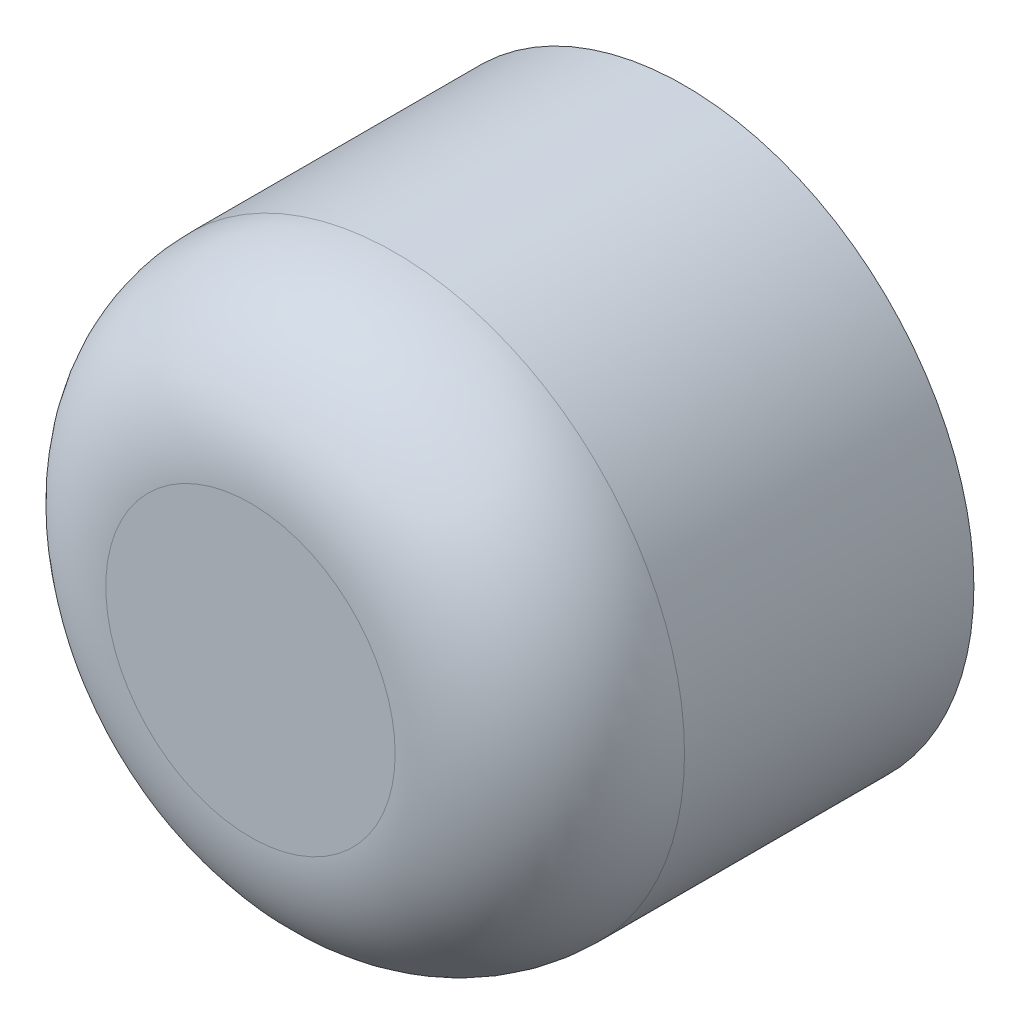
from build123d import *

# Parameters (mm, degrees)
SKETCH2_R           = 50.8
BOSS_EXTRUDE1_DEPTH = 76.2
FILLET1_R           = 25.4


with BuildPart() as part:
    # Sketch2 → Boss-Extrude1 (new body)
    with BuildSketch(Plane.XY):
        with Locations(Location((0, 0, 0), (0, 0, 180))):
            Circle(SKETCH2_R)
    extrude(amount=BOSS_EXTRUDE1_DEPTH)

    # Fillet1
    fillet1_edges = [part.edges().sort_by_distance(p)[0] for p in [
        (50.8, 0, 76.2),
    ]]
    fillet(fillet1_edges, radius=FILLET1_R)


solid = part.part
